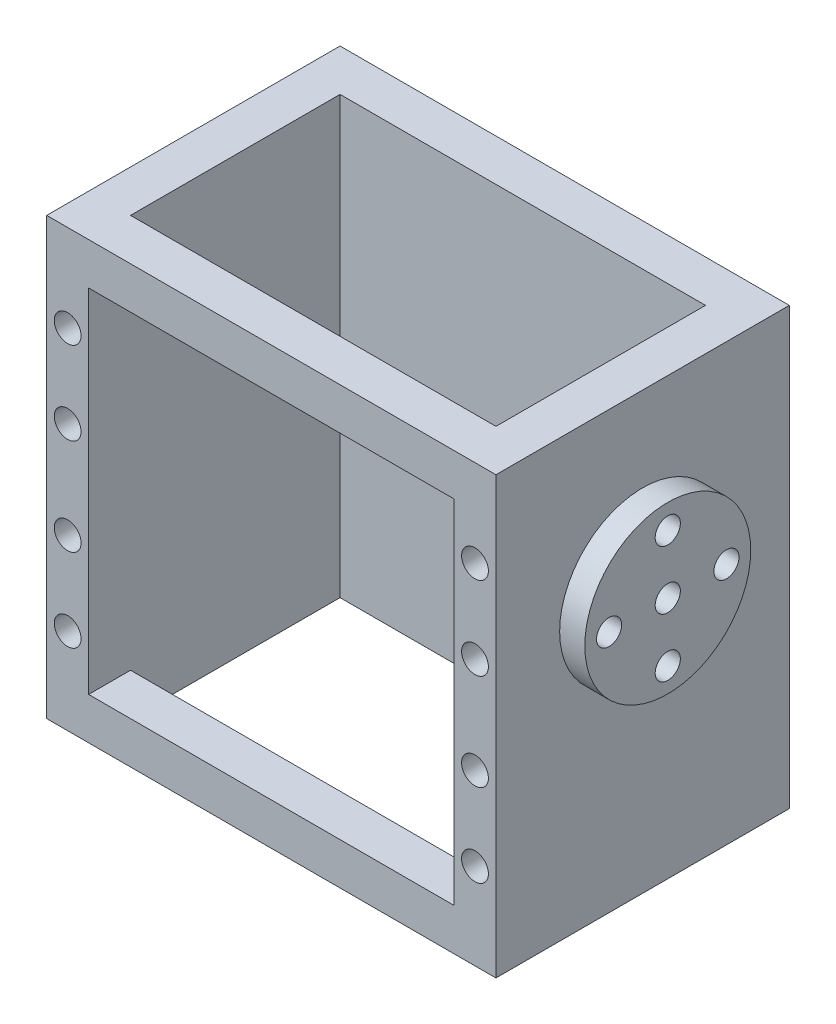
from build123d import *

# Parameters (mm, degrees)
SKETCH1_W           = 53.6
SKETCH1_H           = 35
SKETCH1_W_2         = 43.6
SKETCH1_H_2         = 25
BOSS_EXTRUDE1_DEPTH = 52
SKETCH2_W           = 43.6
SKETCH2_H           = 42
CUT_EXTRUDE1_DEPTH  = 5
SKETCH3_R           = 1.6
SKETCH3_W           = 40
SKETCH3_H           = 20.5
CUT_EXTRUDE2_DEPTH  = 5
SKETCH4_R           = 9.9
SKETCH4_R_2         = 1.5
BOSS_EXTRUDE2_DEPTH = 3
SKETCH5_R           = 9.9
CUT_EXTRUDE3_DEPTH  = 5
SKETCH6_R           = 5
BOSS_EXTRUDE3_DEPTH = 5


with BuildPart() as part:
    # Sketch1 → Boss-Extrude1 (new body)
    with BuildSketch(Plane(origin=(0, 0, 0), x_dir=(1, 0, 0), z_dir=(0, 1, 0))):
        with Locations((26.8, -17.5)):
            Rectangle(SKETCH1_W, SKETCH1_H)
        with Locations((26.8, -17.5)):
            Rectangle(SKETCH1_W_2, SKETCH1_H_2, mode=Mode.SUBTRACT)
    extrude(amount=BOSS_EXTRUDE1_DEPTH)

    # Sketch2 → Cut-Extrude1 (cut)
    with BuildSketch(Plane.XY.offset(35)):
        with Locations((26.8, 26)):
            Rectangle(SKETCH2_W, SKETCH2_H)
    extrude(amount=-CUT_EXTRUDE1_DEPTH, mode=Mode.SUBTRACT)

    # Sketch3 → Cut-Extrude2 (cut)
    with BuildSketch(Plane.XY.offset(35)):
        with Locations((51.1, 20.2)):
            Circle(SKETCH3_R)
        with Locations((51.1, 10.3)):
            Circle(SKETCH3_R)
        with Locations((2.5, 10.3)):
            Circle(SKETCH3_R)
        with Locations((2.5, 20.2)):
            Circle(SKETCH3_R)
        with Locations((51.1, 41.6)):
            Circle(SKETCH3_R)
        with Locations((51.1, 31.7)):
            Circle(SKETCH3_R)
        with Locations((2.5, 31.7)):
            Circle(SKETCH3_R)
        with Locations((2.5, 41.6)):
            Circle(SKETCH3_R)
        with Locations((26.8, 15.25)):
            Rectangle(SKETCH3_W, SKETCH3_H)
        with Locations((26.8, 36.65)):
            Rectangle(SKETCH3_W, SKETCH3_H)
    extrude(amount=-CUT_EXTRUDE2_DEPTH, mode=Mode.SUBTRACT)

    # Sketch4 → Boss-Extrude2 (add)
    with BuildSketch(Plane(origin=(53.6, 0, 0), x_dir=(0, 0, -1), z_dir=(1, 0, 0))):
        with Locations((-17.5, 32)):
            Circle(SKETCH4_R)
        with Locations((-17.5, 39)):
            Circle(SKETCH4_R_2, mode=Mode.SUBTRACT)
        with Locations((-10.5, 32)):
            Circle(SKETCH4_R_2, mode=Mode.SUBTRACT)
        with Locations((-17.5, 25)):
            Circle(SKETCH4_R_2, mode=Mode.SUBTRACT)
        with Locations((-24.5, 32)):
            Circle(SKETCH4_R_2, mode=Mode.SUBTRACT)
        with Locations((-17.5, 32)):
            Circle(SKETCH4_R_2, mode=Mode.SUBTRACT)
    extrude(amount=BOSS_EXTRUDE2_DEPTH)

    # Sketch5 → Cut-Extrude3 (cut)
    with BuildSketch(Plane.ZY.offset(-48.6)):
        with Locations((17.5, 32)):
            Circle(SKETCH5_R)
    extrude(amount=-CUT_EXTRUDE3_DEPTH, mode=Mode.SUBTRACT)


with BuildPart() as cut_extrude3_piece_1:
    # of the separate pieces the step leaves, piece 1, a body of its own (cut_extrude3_pieces)
    add(part.part.solids().sort_by_distance((0, 0, 0))[0])

    # Sketch6 → Boss-Extrude3 (add)
    with BuildSketch(Plane.ZY):
        with Locations((17.5, 32)):
            Circle(SKETCH6_R)
    extrude(amount=BOSS_EXTRUDE3_DEPTH)


with BuildPart() as cut_extrude3_piece_2:
    # of the separate pieces the step leaves, piece 2, a body of its own (cut_extrude3_pieces)
    add(part.part.solids().sort_by_distance((56.6, 32, 7.6))[0])


solid = Compound([cut_extrude3_piece_1.part, cut_extrude3_piece_2.part])
